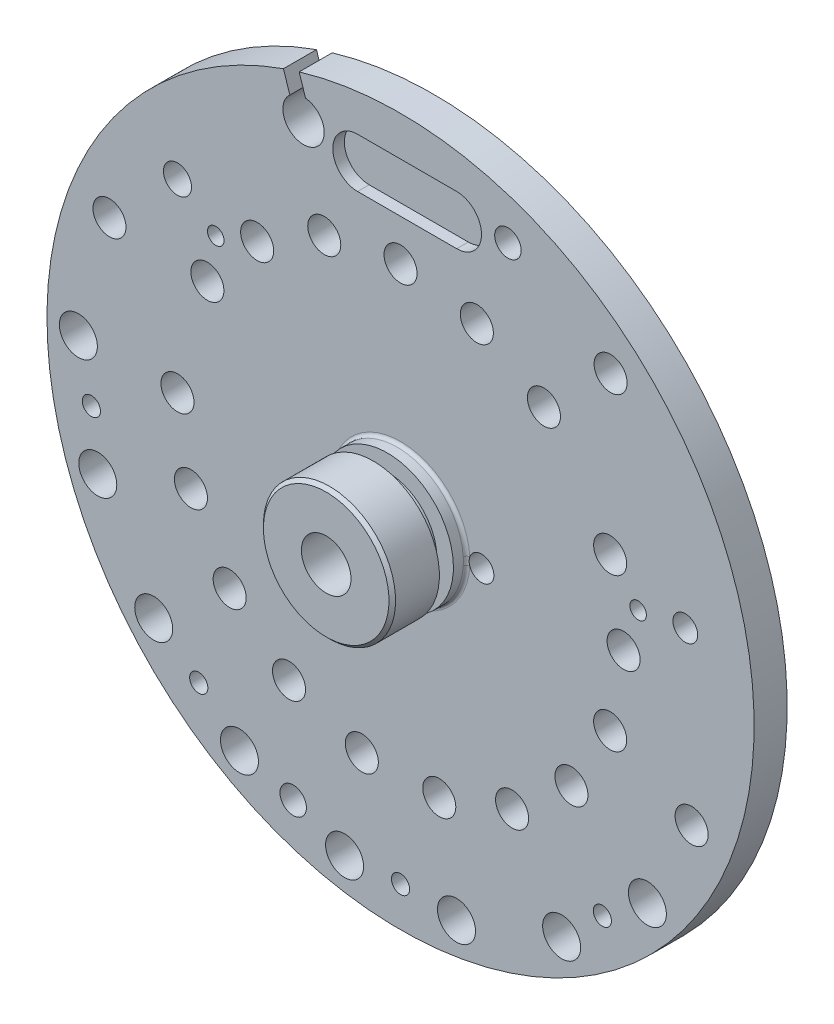
from build123d import *

# Parameters (mm, degrees)
SKETCH1_R                                            = 21.4
BOSS_EXTRUDE1_DEPTH                                  = 2
SKETCH2_R                                            = 6.5
BOSS_EXTRUDE2_DEPTH                                  = 4.7
SKETCH3_R                                            = 4
BOSS_EXTRUDE3_DEPTH                                  = 4.5
SKETCH5_R                                            = 3.25
CUT_EXTRUDE2_DEPTH                                   = 5.2
CUT_EXTRUDE1_REACH                                   = 34.27
SKETCH4_R                                            = 1.5
SKETCH6_W                                            = 0.85
SKETCH6_H                                            = 1
CUT_EXTRUDE3_DEPTH                                   = 31.996935332
CUT_EXTRUDE3_DEPTH_BACK                              = 31.996935332
SKETCH7_W                                            = 0.5
SKETCH7_H                                            = 5.5
CUT_EXTRUDE4_DEPTH                                   = 0.7
F_2_0_2_DIAMETER_HOLE6_D                             = 2
FILLET2_R                                            = 1
F_2_3_2_3_DIAMETER_HOLE1_D                           = 2.3
F_2_0_2_DIAMETER_HOLE8_D                             = 2
F_2_5_2_5_DIAMETER_HOLE1_D                           = 2.5
F_1_0_1_DIAMETER_HOLE1_D                             = 1
F_1_7_1_7_DIAMETER_HOLE2_D                           = 1.7
M1_4X0_3_TAPPED_HOLE1_D                              = 1.1
M2_TAPPED_HOLE1_D                                    = 1.6
CBORE_FOR_M1_7_HEX_SOCKET_HEAD_CAP_SCREW_D           = 1.5
CBORE_FOR_M1_7_HEX_SOCKET_HEAD_CAP_SCREW_CBORE_D     = 1.8
CBORE_FOR_M1_7_HEX_SOCKET_HEAD_CAP_SCREW_CBORE_DEPTH = 0.5
CBORE_FOR_M1_7_HEX_SOCKET_HEAD_CAP_S_2_D             = 1.5
CBORE_FOR_M1_7_HEX_SOCKET_HEAD_CAP_S_2_CBORE_D       = 1.8
CBORE_FOR_M1_7_HEX_SOCKET_HEAD_CAP_S_2_CBORE_DEPTH   = 1.2
CUT_EXTRUDE5_DEPTH                                   = 31.954321185
FILLET3_R                                            = 0.2
CHAMFER1_SIZE                                        = 0.2


with BuildPart() as part:
    # Sketch1 → Boss-Extrude1 (new body)
    with BuildSketch(Plane.XY):
        Circle(SKETCH1_R)
    extrude(amount=-BOSS_EXTRUDE1_DEPTH)

    # Sketch2 → Boss-Extrude2 (add)
    with BuildSketch(Plane(origin=(0, 0, -2), x_dir=(-1, 0, 0), z_dir=(0, 0, -1))):
        with Locations(Location((0, 0, 0), (0, 0, 180))):
            Circle(SKETCH2_R)
    extrude(amount=BOSS_EXTRUDE2_DEPTH)

    # Sketch3 → Boss-Extrude3 (add)
    with BuildSketch(Plane.XY):
        with Locations(Location((0, 0, 0), (0, 0, 180))):
            Circle(SKETCH3_R)
    extrude(amount=BOSS_EXTRUDE3_DEPTH)

    # Sketch5 → Cut-Extrude2 (cut)
    with BuildSketch(Plane(origin=(0, 0, -6.7), x_dir=(-1, 0, 0), z_dir=(0, 0, -1))):
        Circle(SKETCH5_R)
    extrude(amount=-CUT_EXTRUDE2_DEPTH, mode=Mode.SUBTRACT)

    # Sketch4 → Cut-Extrude1 (cut, up to next)
    with BuildSketch(Plane.XY.offset(4.5), mode=Mode.PRIVATE) as cut_extrude1_sk1:
        Circle(SKETCH4_R)
    cut_extrude1_tool1 = extrude(cut_extrude1_sk1.sketch, amount=-CUT_EXTRUDE1_REACH, mode=Mode.PRIVATE) & part.part
    add(cut_extrude1_tool1.solids().sort_by_distance((0, 0, 4.5))[0], mode=Mode.SUBTRACT)

    # Sketch6 → Cut-Revolve1 (revolve, cut)
    with BuildSketch(Plane(origin=(0, 0, 0), x_dir=(0, 0, -1), z_dir=(1, 0, 0)), mode=Mode.PRIVATE) as cut_revolve1_sk:
        with Locations((-1.225, 3.5)):
            Rectangle(SKETCH6_W, SKETCH6_H)
    revolve(cut_revolve1_sk.sketch.rotate(Axis((0, 0, 4.5), (0, 0, -1)), 270), axis=Axis((0, 0, 4.5), (0, 0, -1)), mode=Mode.SUBTRACT)

    # Sketch7 → Cut-Extrude3 (cut, two sides: drawn at the far end of the back side and taken through both)
    with BuildSketch(Plane(origin=(0, 0, 0), x_dir=(0, 0, -1), z_dir=(1, 0, 0)).offset(-CUT_EXTRUDE3_DEPTH_BACK)):
        with Locations((6.45, 0)):
            Rectangle(SKETCH7_W, SKETCH7_H)
    extrude(amount=CUT_EXTRUDE3_DEPTH + CUT_EXTRUDE3_DEPTH_BACK, mode=Mode.SUBTRACT)

    # Sketch8 → Cut-Extrude4 (cut)
    with BuildSketch(Plane.XY):
        with BuildLine():
            Line((-2.6, 19), (3.4, 19))
            ThreePointArc((3.4, 19), (4.9, 17.5), (3.4, 16))
            Line((3.4, 16), (-2.6, 16))
            ThreePointArc((-2.6, 16), (-4.1, 17.5), (-2.6, 19))
        make_face()
    extrude(amount=-CUT_EXTRUDE4_DEPTH, mode=Mode.SUBTRACT)

    # Ø2.0 (2) Diameter Hole6 (through all)
    with Locations(Plane(origin=(0, 0, -2), x_dir=(1, 0, 0), z_dir=(0, 0, -1))):
        with Locations((-11.691342951, -6.75), (-8.677632731, -10.341599982), (-4.617271935, -12.685850381), (4.617271935, -12.685850381), (0, -13.5), (8.677632731, -10.341599982), (-12.685850381, 4.617271935), (-10.341599982, 8.677632731), (-6.75, 11.691342951), (2.344250399, 13.294904666), (6.75, 11.691342951), (10.341599982, 8.677632731), (12.685850381, 4.617271935), (13.5, 0), (12.685850381, -4.617271935), (-13.5, 0), (-2.344250399, 13.294904666)):
            Hole(F_2_0_2_DIAMETER_HOLE6_D / 2)

    # Fillet2
    fillet2_edges = [part.edges().sort_by_distance(p)[0] for p in [
        (-6.5, 0, -2),
    ]]
    fillet(fillet2_edges, radius=FILLET2_R)

    # Ø2.3 (2.3) Diameter Hole1 (through all)
    with Locations(Plane(origin=(0, 0, -2), x_dir=(1, 0, 0), z_dir=(0, 0, -1))):
        with Locations((-19.5, 0), (-18.324006105, 6.669392795), (-14.937866641, 12.534358389), (-9.75, 16.887495374), (-3.386139465, 19.203751184), (3.386139465, 19.203751184), (9.75, 16.887495374), (14.937866641, 12.534358389)):
            Hole(F_2_3_2_3_DIAMETER_HOLE1_D / 2)

    # Ø2.0 (2) Diameter Hole8 (through all)
    with Locations(Plane(origin=(0, 0, -2), x_dir=(1, 0, 0), z_dir=(0, 0, -1))):
        with Locations((-17.616493237, -7.117525275), (12.713481521, -14.119751684), (17.616493237, 7.117525275)):
            Hole(F_2_0_2_DIAMETER_HOLE8_D / 2)

    # Ø2.5 (2.5) Diameter Hole1 (through all)
    with Locations(Plane(origin=(0, 0, -2), x_dir=(1, 0, 0), z_dir=(0, 0, -1))):
        with Locations((-5.871322893, -18.07007381)):
            Hole(F_2_5_2_5_DIAMETER_HOLE1_D / 2)

    # Ø1.0 (1) Diameter Hole1 (through all)
    with Locations(Plane(origin=(0, 0, -2), x_dir=(1, 0, 0), z_dir=(0, 0, -1))):
        with Locations((14.378193194, -2.535263394), (-11.18424887, -9.384699101)):
            Hole(F_1_0_1_DIAMETER_HOLE1_D / 2)

    # Ø1.7 (1.7) Diameter Hole2 (through all)
    with Locations(Plane(origin=(0, 0, -2), x_dir=(-1, 0, 0), z_dir=(0, 0, -1))):
        with Locations((13.5, 11.2)):
            Hole(F_1_7_1_7_DIAMETER_HOLE2_D / 2)

    # M1.4x0.3 Tapped Hole1 (through all)
    with Locations(Plane(origin=(0, 0, -2), x_dir=(1, 0, 0), z_dir=(0, 0, -1))):
        with Locations((-18.711347307, 3.299315376), (12.212964584, 14.554844419), (-12.212964584, 14.554844419), (0, 19)):
            Hole(M1_4X0_3_TAPPED_HOLE1_D / 2)

    # M2 Tapped Hole1 (through all)
    with Locations(Plane.XY):
        with Locations((6.498382723, 17.854159795), (-6.498382723, -17.854159795)):
            Hole(M2_TAPPED_HOLE1_D / 2)

    # CBORE for M1.7 Hex Socket Head Cap Screw (through all)
    with Locations(Plane(origin=(0, 0, -2), x_dir=(1, 0, 0), z_dir=(0, 0, -1))):
        with Locations((17.234135678, -3.038843109)):
            CounterBoreHole(CBORE_FOR_M1_7_HEX_SOCKET_HEAD_CAP_SCREW_D / 2, CBORE_FOR_M1_7_HEX_SOCKET_HEAD_CAP_SCREW_CBORE_D / 2, CBORE_FOR_M1_7_HEX_SOCKET_HEAD_CAP_SCREW_CBORE_DEPTH)

    # CBORE for M1.7 Hex Socket Head Cap S 2 (through all)
    with Locations(Plane(origin=(0, 0, -6.2), x_dir=(-1, 0, 0), z_dir=(0, 0, -1))):
        with Locations((-4.9, 0)):
            CounterBoreHole(CBORE_FOR_M1_7_HEX_SOCKET_HEAD_CAP_S_2_D / 2, CBORE_FOR_M1_7_HEX_SOCKET_HEAD_CAP_S_2_CBORE_D / 2, CBORE_FOR_M1_7_HEX_SOCKET_HEAD_CAP_S_2_CBORE_DEPTH)

    # Sketch41 → Cut-Extrude5 (cut, through all)
    with BuildSketch(Plane.XY.offset(-2)):
        with BuildLine():
            Line((-5.749818077, 19.314154426), (-6.135630169, 20.501561951))
            ThreePointArc((-6.135630169, 20.501561951), (-6.61296368, 20.352609449), (-7.086686686, 20.192544957))
            Line((-7.086686686, 20.192544957), (-6.700874593, 19.005137431))
            ThreePointArc((-6.700874593, 19.005137431), (-6.257594136, 19.258894455), (-5.749818077, 19.314154426))
        make_face()
    extrude(amount=CUT_EXTRUDE5_DEPTH, mode=Mode.SUBTRACT)

    # Fillet3
    fillet3_edges = [part.edges().sort_by_distance(p)[0] for p in [
        (4, 0, 0),
    ]]
    fillet(fillet3_edges, radius=FILLET3_R)

    # Chamfer1
    chamfer1_edges = [part.edges().sort_by_distance(p)[0] for p in [
        (4, 0, 4.5),
    ]]
    chamfer(chamfer1_edges, length=CHAMFER1_SIZE)


solid = part.part
